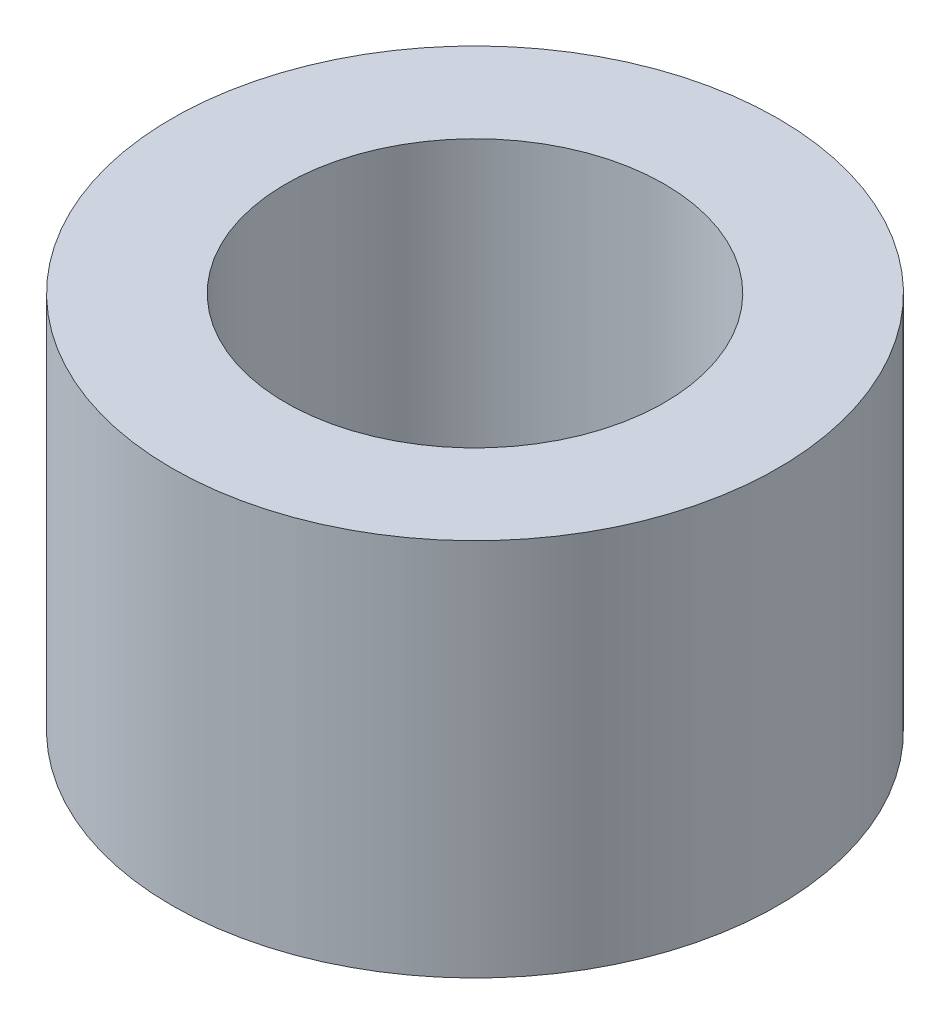
from build123d import *

# Parameters (mm, degrees)
SKETCH1_R           = 3.81
SKETCH1_R_2         = 2.38125
BOSS_EXTRUDE1_DEPTH = 4.7625


with BuildPart() as part:
    # Sketch1 → Boss-Extrude1 (new body)
    with BuildSketch(Plane(origin=(0, 0, 0), x_dir=(1, 0, 0), z_dir=(0, 1, 0))):
        with Locations(Location((0, 0, 0), (0, 0, 90))):
            Circle(SKETCH1_R)
        with Locations(Location((0, 0, 0), (0, 0, 90))):
            Circle(SKETCH1_R_2, mode=Mode.SUBTRACT)
    extrude(amount=BOSS_EXTRUDE1_DEPTH)


solid = part.part
